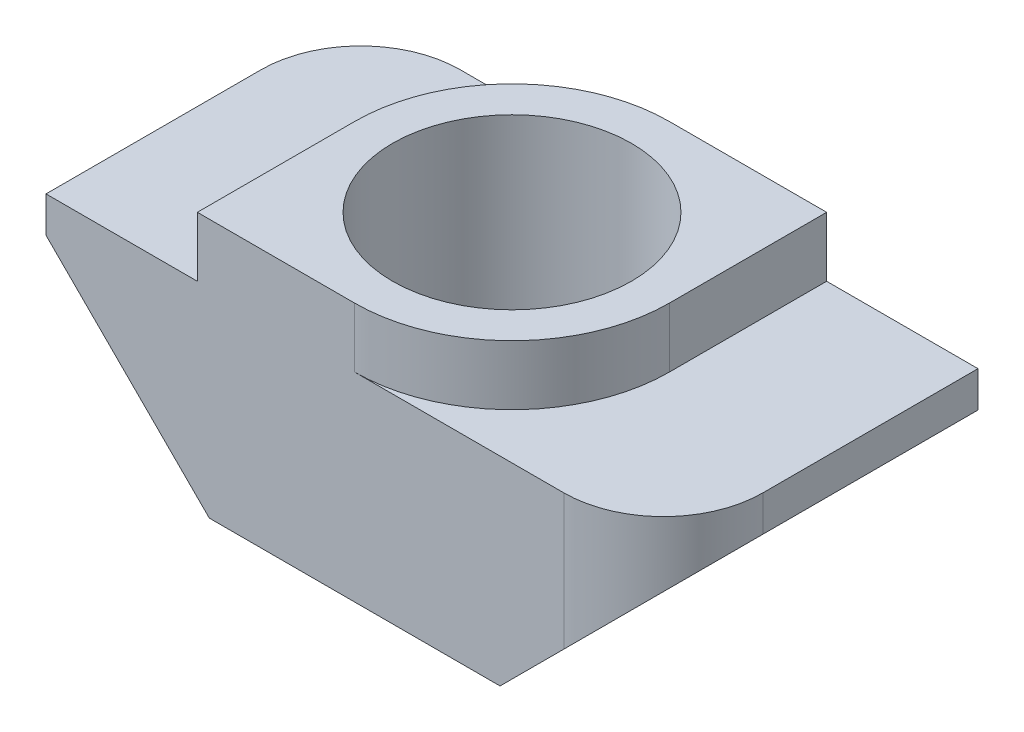
from build123d import *

# Parameters (mm, degrees)
SKETCH_1_W          = 15.5
SKETCH_1_H          = 7.9
EXTRUDE_1_DEPTH     = 5
EXTRUDE_START       = 5
EXTRUDE_2_DEPTH     = 1.5
CUT_EXTRUDE_2_DEPTH = 19.571752744
CUT_EXTRUDE_3_REACH = 20.572
SKETCH_2_5_R        = 3
CUT_EXTRUDE_4_DEPTH = 19.571752744


with BuildPart() as part:
    # 草图1 → 凸台-拉伸1 (new body)
    with BuildSketch(Plane(origin=(0, 0, 0), x_dir=(1, 0, 0), z_dir=(0, 1, 0))):
        with Locations((7.75, 3.95)):
            Rectangle(SKETCH_1_W, SKETCH_1_H)
    extrude(amount=EXTRUDE_1_DEPTH)

    # 草图2 → 凸台-拉伸2 (add)
    with BuildSketch(Plane(origin=(0, 0, 0), x_dir=(1, 0, 0), z_dir=(0, 1, 0)).offset(EXTRUDE_START)):
        with BuildLine():
            Line((3.8, 3.95), (3.8, 0))
            Line((3.8, 0), (7.75, 0))
            ThreePointArc((7.75, 0), (10.543071786, 1.156928214), (11.7, 3.95))
            Line((11.7, 3.95), (11.7, 7.9))
            Line((11.7, 7.9), (7.75, 7.9))
            ThreePointArc((7.75, 7.9), (4.956928214, 6.743071786), (3.8, 3.95))
        make_face()
    extrude(amount=EXTRUDE_2_DEPTH)

    # 草图3 → 切除-拉伸2 (cut, through all)
    with BuildSketch(Plane.XY):
        Polygon((0, 4.1), (4.1, 0), (0, 0), align=None)
        Polygon((11.4, 0), (15.5, 4.1), (15.5, 0), align=None)
    extrude(amount=-CUT_EXTRUDE_2_DEPTH, mode=Mode.SUBTRACT)

    # 草图4 → 切除-拉伸3 (cut, up to next)
    with BuildSketch(Plane(origin=(0, 0, 0), x_dir=(1, 0, 0), z_dir=(0, 1, 0)), mode=Mode.PRIVATE) as cut_extrude_3_sk1:
        with BuildLine():
            Line((2.5, 7.9), (0, 7.9))
            Line((0, 7.9), (0, 5.4))
            ThreePointArc((0, 5.4), (0.732233047, 7.167766953), (2.5, 7.9))
        make_face()
    cut_extrude_3_tool1 = extrude(cut_extrude_3_sk1.sketch, amount=CUT_EXTRUDE_3_REACH, mode=Mode.PRIVATE) & part.part
    # 草图4 → 切除-拉伸3 (cut, up to next)
    with BuildSketch(Plane(origin=(0, 0, 0), x_dir=(1, 0, 0), z_dir=(0, 1, 0)), mode=Mode.PRIVATE) as cut_extrude_3_sk2:
        with BuildLine():
            Line((13, 0), (15.5, 0))
            Line((15.5, 0), (15.5, 2.5))
            ThreePointArc((15.5, 2.5), (14.767766953, 0.732233047), (13, 0))
        make_face()
    cut_extrude_3_tool2 = extrude(cut_extrude_3_sk2.sketch, amount=CUT_EXTRUDE_3_REACH, mode=Mode.PRIVATE) & part.part
    add(cut_extrude_3_tool1.solids().sort_by_distance((0.55842, 0, -7.34158))[0], mode=Mode.SUBTRACT)
    add(cut_extrude_3_tool2.solids().sort_by_distance((14.94158, 0, -0.55842))[0], mode=Mode.SUBTRACT)

    # 草图2<5> → 切除-拉伸4 (cut, through all)
    with BuildSketch(Plane(origin=(0, 0, 0), x_dir=(1, 0, 0), z_dir=(0, 1, 0))):
        with Locations(Location((7.75, 3.95, 0), (0, 0, 270))):
            Circle(SKETCH_2_5_R)
    extrude(amount=CUT_EXTRUDE_4_DEPTH, mode=Mode.SUBTRACT)


solid = part.part
